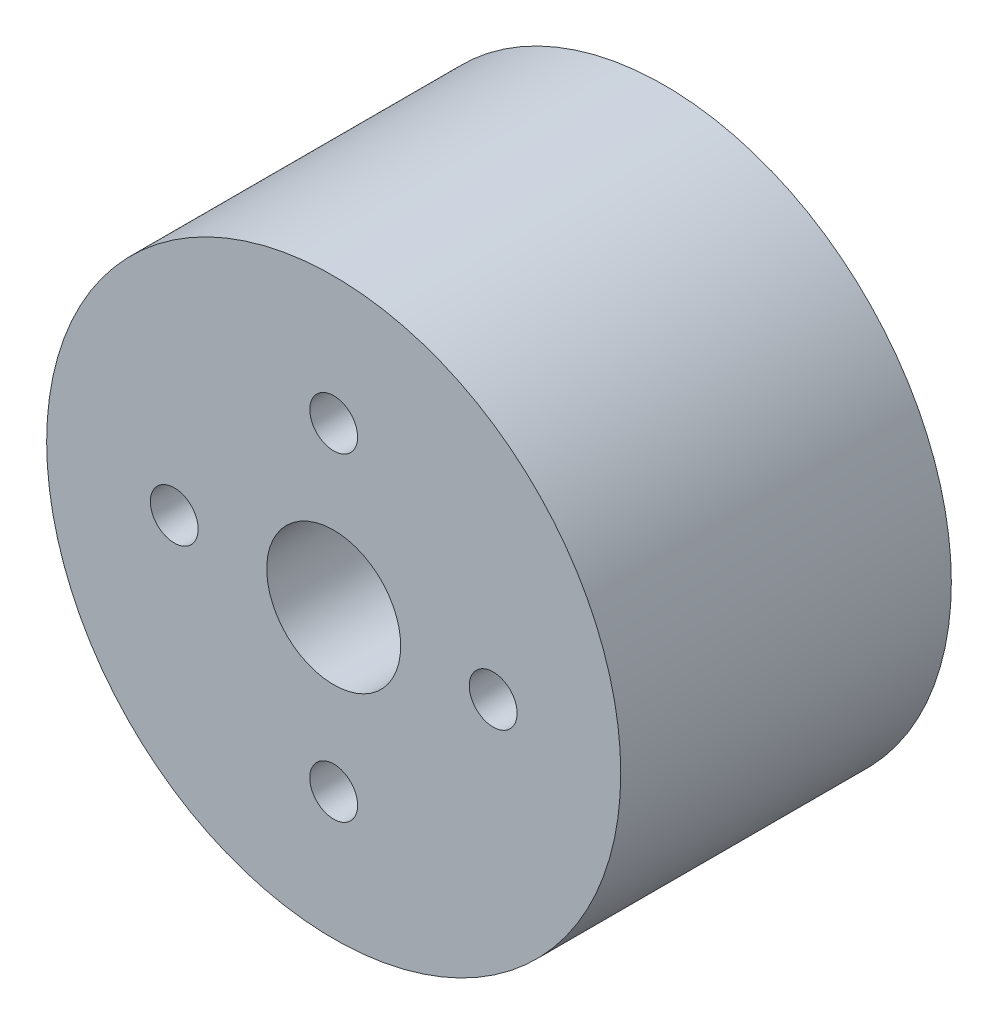
from build123d import *

# Parameters (mm, degrees)
SKETCH1_R           = 18
SKETCH1_R_2         = 1.5
SKETCH1_R_3         = 4.2
BOSS_EXTRUDE2_DEPTH = 20.73


with BuildPart() as part:
    # Sketch1 → Boss-Extrude2 (new body)
    with BuildSketch(Plane.XY):
        Circle(SKETCH1_R)
        with Locations((0, 10)):
            Circle(SKETCH1_R_2, mode=Mode.SUBTRACT)
        Circle(SKETCH1_R_3, mode=Mode.SUBTRACT)
        with Locations((10, 0)):
            Circle(SKETCH1_R_2, mode=Mode.SUBTRACT)
        with Locations((0, -10)):
            Circle(SKETCH1_R_2, mode=Mode.SUBTRACT)
        with Locations((-10, 0)):
            Circle(SKETCH1_R_2, mode=Mode.SUBTRACT)
    extrude(amount=BOSS_EXTRUDE2_DEPTH)


solid = part.part
